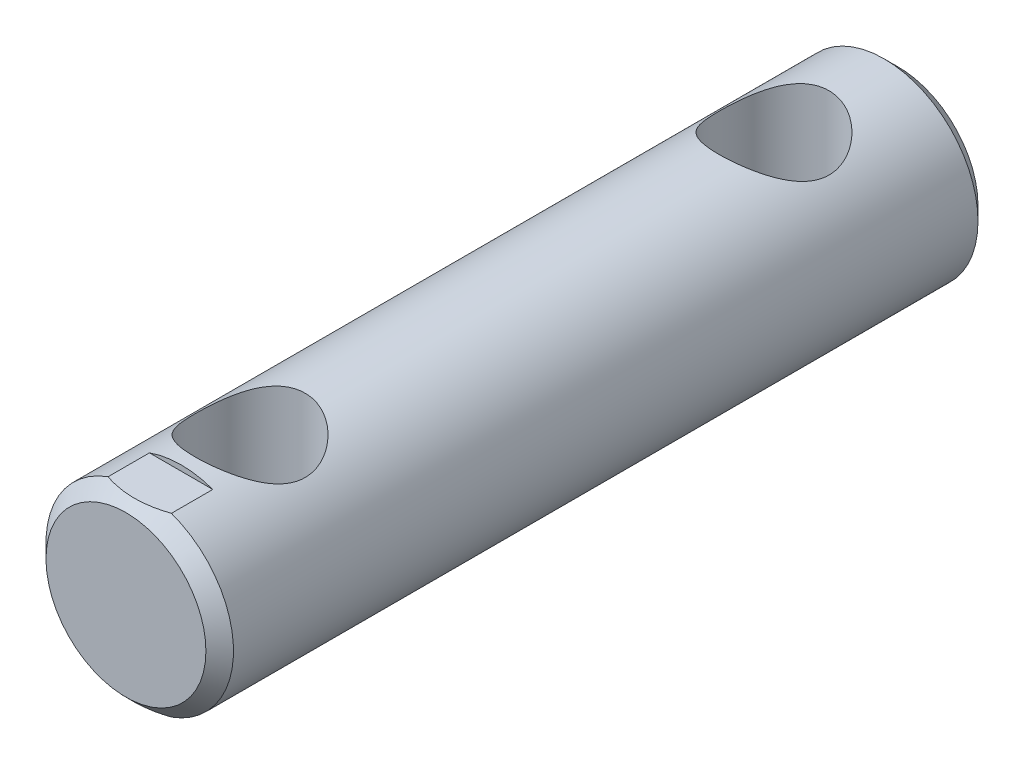
from build123d import *

# Parameters (mm, degrees)
ESQUISSE1_R                  = 3.4
BOSS_EXTRU_1_DEPTH           = 28
ENL_V_MAT_EXTRU_1_DEPTH      = 29.409857444
ENL_V_MAT_EXTRU_1_DEPTH_BACK = 29.409857444
ESQUISSE2_R                  = 2
CHANFREIN1_SIZE              = 0.5
ESQUISSE3_W                  = 6.25957
ESQUISSE3_H                  = 2.330719663
ENL_V_MAT_EXTRU_2_DEPTH      = 2


with BuildPart() as part:
    # Esquisse1 → Boss.-Extru.1 (new body)
    with BuildSketch(Plane.XY):
        Circle(ESQUISSE1_R)
    extrude(amount=BOSS_EXTRU_1_DEPTH)

    # Esquisse2 → Enlèv. mat.-Extru.1 (cut, two sides: drawn at the far end of the back side and taken through both)
    with BuildSketch(Plane(origin=(0, 0, 0), x_dir=(1, 0, 0), z_dir=(0, 1, 0)).offset(-ENL_V_MAT_EXTRU_1_DEPTH_BACK)):
        with Locations(Location((0, -4.5, 0), (0, 0, 270))):
            Circle(ESQUISSE2_R)
        with Locations(Location((0, -23.5, 0), (0, 0, 270))):
            Circle(ESQUISSE2_R)
    extrude(amount=ENL_V_MAT_EXTRU_1_DEPTH + ENL_V_MAT_EXTRU_1_DEPTH_BACK, mode=Mode.SUBTRACT)

    # Chanfrein1
    chanfrein1_edges = [part.edges().sort_by_distance(p)[0] for p in [
        (-3.4, 0, 0),
        (-3.4, 0, 28),
    ]]
    chamfer(chanfrein1_edges, length=CHANFREIN1_SIZE)

    # Esquisse3 → Enlèv. mat.-Extru.2 (cut)
    with BuildSketch(Plane.XY.offset(28)):
        with Locations((0, 4.365359832)):
            Rectangle(ESQUISSE3_W, ESQUISSE3_H)
        with Locations((0, -4.365359832)):
            Rectangle(ESQUISSE3_W, ESQUISSE3_H)
    extrude(amount=-ENL_V_MAT_EXTRU_2_DEPTH, mode=Mode.SUBTRACT)


solid = part.part
